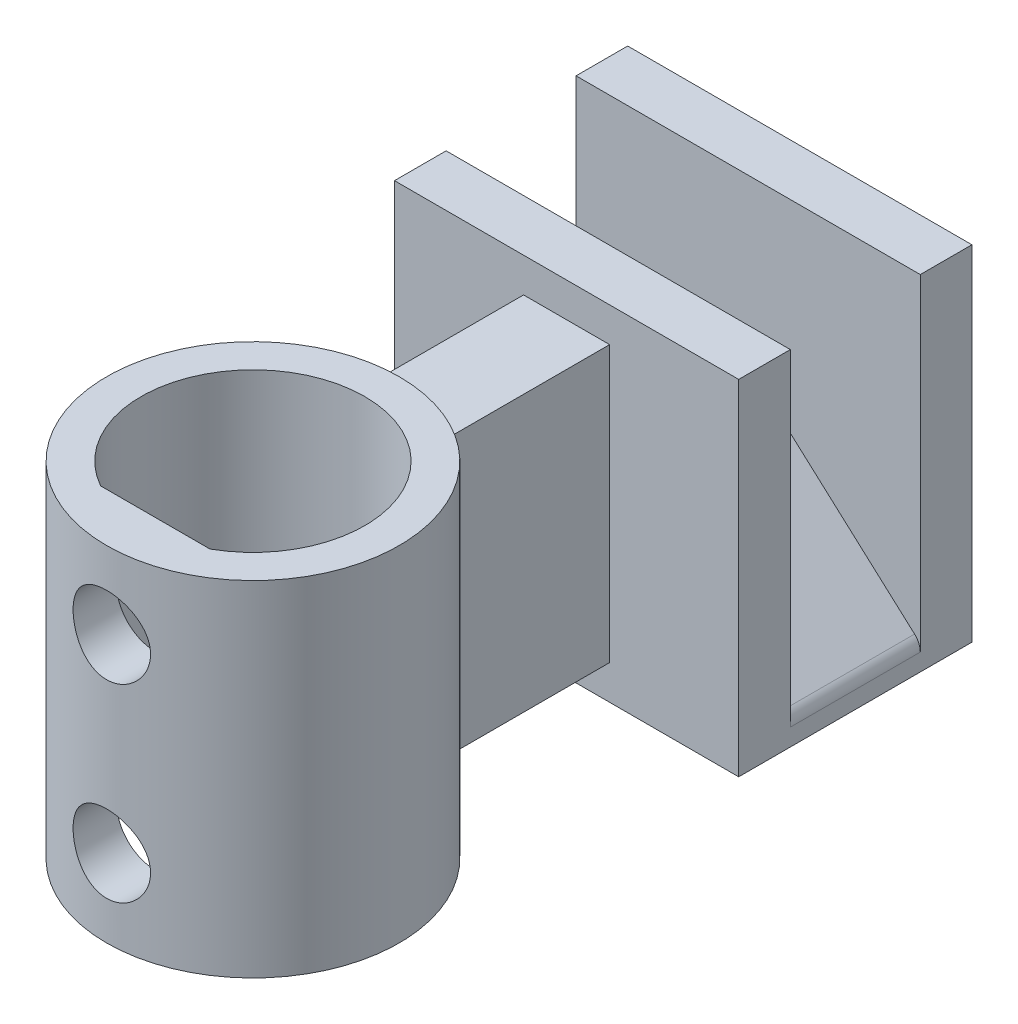
from build123d import *

# Parameters (mm, degrees)
SKETCH2_W                       = 20
SKETCH2_H                       = 10
BOSS_EXTRUDE1_DEPTH             = 3.775
CHAMFER1_SIZE                   = 9.5
CHAMFER1_SIZE2                  = 8.553838421
FILLET3_R                       = 1
SKETCH3_W                       = 20
SKETCH3_H                       = 20
BOSS_EXTRUDE2_DEPTH             = 3
BOSS_EXTRUDE3_REACH             = 21.259
SKETCH6_R                       = 8.5
BOSS_EXTRUDE3_DIRECTION_2_REACH = 21.259
BOSS_EXTRUDE4_REACH             = 34.237
BOSS_EXTRUDE4_END_RADIUS        = 8.5
SKETCH5_W                       = 5
SKETCH5_H                       = 16
CUT_EXTRUDE1_REACH              = 34.278
CUT_EXTRUDE1_END_RADIUS         = 8.5
SKETCH7_R                       = 2.25


with BuildPart() as part:
    # Sketch2 → Boss-Extrude1 (new, symmetric)
    with BuildSketch(Plane.XY):
        Rectangle(SKETCH2_W, SKETCH2_H)
    extrude(amount=BOSS_EXTRUDE1_DEPTH, both=True)

    # Chamfer1
    chamfer1_edges = [part.edges().sort_by_distance(p)[0] for p in [
        (-10, 5, 0),
        (10, 5, 0),
    ]]
    chamfer1_side = [part.faces().sort_by_distance(p)[0] for p in [
        (0, 5, 0),
    ]]
    chamfer(chamfer1_edges, length=CHAMFER1_SIZE, length2=CHAMFER1_SIZE2, reference=chamfer1_side[0])

    # Fillet3
    fillet3_edges = [part.edges().sort_by_distance(p)[0] for p in [
        (-0.5, 5, 0),
        (0.5, 5, 0),
        (10, -3.553838421, 0),
        (-10, -3.553838421, 0),
    ]]
    fillet(fillet3_edges, radius=FILLET3_R)

    # Sketch3 → Boss-Extrude2 (add)
    with BuildSketch(Plane.XY.offset(3.775)):
        with Locations((0, 5)):
            Rectangle(SKETCH3_W, SKETCH3_H)
    boss_extrude2 = extrude(amount=BOSS_EXTRUDE2_DEPTH)

    # Mirror1: Boss-Extrude2 across plane
    add(boss_extrude2.mirror(Plane.XY))


with BuildPart() as body_2:

    # Boss-Extrude3: up to this face of the body (flat: up to its plane)
    boss_extrude3_end = Plane(part.part.faces().sort_by_distance((0, 15, 5.275))[0])
    # Sketch6 → Boss-Extrude3 (new, up to the picked face)
    with BuildSketch(Plane(origin=(0, 0, 0), x_dir=(1, 0, 0), z_dir=(0, 1, 0)), mode=Mode.PRIVATE) as boss_extrude3_sk1:
        with Locations(Location((0, -25, 0), (0, 0, 90))):
            Circle(SKETCH6_R)
        with BuildLine():
            Line((-3.175, -30.671805268), (3.175, -30.671805268))
            ThreePointArc((3.175, -30.671805268), (0, -18.5), (-3.175, -30.671805268))
        make_face(mode=Mode.SUBTRACT)
    boss_extrude3_tool1 = split(extrude(boss_extrude3_sk1.sketch, amount=BOSS_EXTRUDE3_REACH, mode=Mode.PRIVATE), bisect_by=boss_extrude3_end, keep=Keep.BOTH, mode=Mode.PRIVATE)
    add(boss_extrude3_tool1.solids().sort_by(Axis((0, 0, 33.259584), (0, 1, 0)))[0])


    # Boss-Extrude3 direction 2: up to this face of the body (flat: up to its plane)
    boss_extrude3_direction_2_end = Plane(part.part.faces().sort_by_distance((0, -5, 0))[0])
    # Sketch6 → Boss-Extrude3 direction 2 (add, up to the picked face)
    with BuildSketch(Plane(origin=(0, 0, 0), x_dir=(1, 0, 0), z_dir=(0, 1, 0)), mode=Mode.PRIVATE) as boss_extrude3_direction_2_sk1:
        with Locations(Location((0, -25, 0), (0, 0, 90))):
            Circle(SKETCH6_R)
        with BuildLine():
            Line((-3.175, -30.671805268), (3.175, -30.671805268))
            ThreePointArc((3.175, -30.671805268), (0, -18.5), (-3.175, -30.671805268))
        make_face(mode=Mode.SUBTRACT)
    boss_extrude3_direction_2_tool1 = split(extrude(boss_extrude3_direction_2_sk1.sketch, amount=-BOSS_EXTRUDE3_DIRECTION_2_REACH, mode=Mode.PRIVATE), bisect_by=boss_extrude3_direction_2_end, keep=Keep.BOTH, mode=Mode.PRIVATE)
    add(boss_extrude3_direction_2_tool1.solids().sort_by(Axis((0, 0, 33.259584), (0, -1, 0)))[0])


with BuildPart() as part_1:
    add(part.part)

    add(body_2.part)  # Boss-Extrude4 merges body 2
    # Boss-Extrude4: up to this cylinder (the profile starts outside it)
    boss_extrude4_end = Plane(origin=(0, 5, 25), z_dir=(0, -1, 0)) * Cylinder(BOSS_EXTRUDE4_END_RADIUS, 86.474, mode=Mode.PRIVATE)
    # Sketch5 → Boss-Extrude4 (add, up to the surface)
    with BuildSketch(Plane.XY.offset(6.775), mode=Mode.PRIVATE) as boss_extrude4_sk1:
        with Locations((0, 5)):
            Rectangle(SKETCH5_W, SKETCH5_H)
    boss_extrude4_tool1 = extrude(boss_extrude4_sk1.sketch, amount=BOSS_EXTRUDE4_REACH, mode=Mode.PRIVATE) - boss_extrude4_end
    add(boss_extrude4_tool1.solids().sort_by_distance((0, 5, 6.775))[0])

    # Cut-Extrude1: up to this cylinder (the profile starts inside it)
    cut_extrude1_end = Plane(origin=(0, 5, 25), z_dir=(0, -1, 0)) * Cylinder(CUT_EXTRUDE1_END_RADIUS, 97.556, mode=Mode.PRIVATE)
    # Sketch7 → Cut-Extrude1 (cut, up to the surface)
    with BuildSketch(Plane.XY.offset(20), mode=Mode.PRIVATE) as cut_extrude1_sk1:
        with Locations(Location((0, 10.5, 0), (0, 0, 180))):
            Circle(SKETCH7_R)
    cut_extrude1_tool1 = extrude(cut_extrude1_sk1.sketch, amount=CUT_EXTRUDE1_REACH, mode=Mode.PRIVATE) & cut_extrude1_end
    add(cut_extrude1_tool1.solids().sort_by_distance((0, 10.5, 20))[0], mode=Mode.SUBTRACT)
    # Sketch7 → Cut-Extrude1 (cut, up to the surface)
    with BuildSketch(Plane.XY.offset(20), mode=Mode.PRIVATE) as cut_extrude1_sk2:
        with Locations(Location((0, -0.5, 0), (0, 0, 180))):
            Circle(SKETCH7_R)
    cut_extrude1_tool2 = extrude(cut_extrude1_sk2.sketch, amount=CUT_EXTRUDE1_REACH, mode=Mode.PRIVATE) & cut_extrude1_end
    add(cut_extrude1_tool2.solids().sort_by_distance((0, -0.5, 20))[0], mode=Mode.SUBTRACT)


solid = part_1.part
